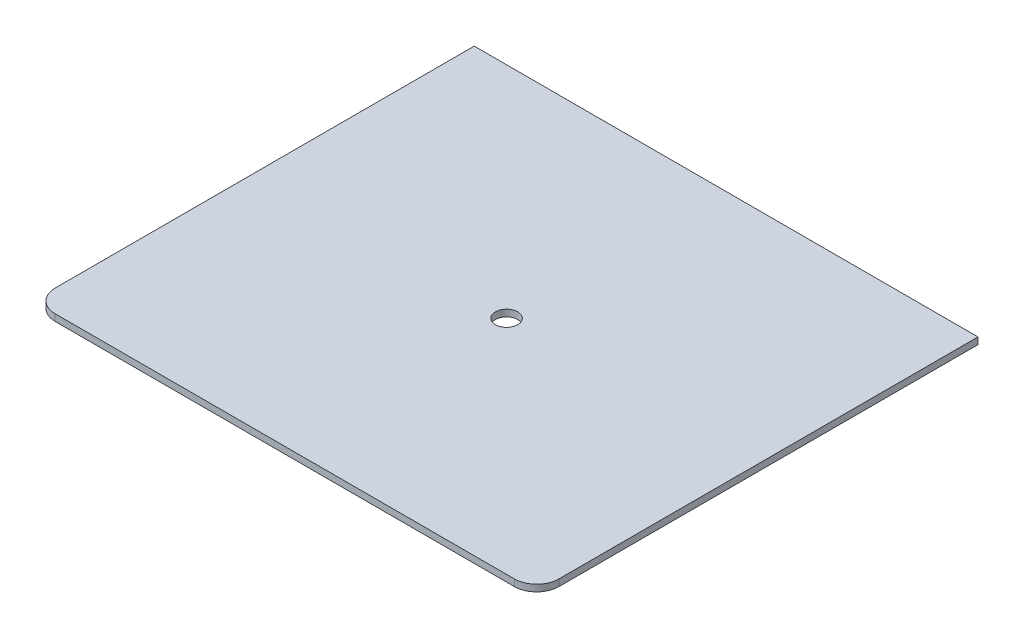
from build123d import *

# Parameters (mm, degrees)
SKETCH1_W           = 226
SKETCH1_H           = 198
BOSS_EXTRUDE1_DEPTH = 3
INPUT_FOR_SPEAKER_R = 5
CUT_EXTRUDE1_DEPTH  = 10
FILLET1_R           = 10


with BuildPart() as part:
    # Sketch1 → Boss-Extrude1 (new body)
    with BuildSketch(Plane(origin=(0, 0, 0), x_dir=(1, 0, 0), z_dir=(0, 1, 0))):
        with Locations((113, 99)):
            Rectangle(SKETCH1_W, SKETCH1_H)
    extrude(amount=BOSS_EXTRUDE1_DEPTH)

    # Input for speaker → Cut-Extrude1 (cut)
    with BuildSketch(Plane(origin=(0, 3, 0), x_dir=(1, 0, 0), z_dir=(0, 1, 0))):
        with Locations(Location((113, 99.5, 0), (0, 0, 270))):
            Circle(INPUT_FOR_SPEAKER_R)
    extrude(amount=-CUT_EXTRUDE1_DEPTH, mode=Mode.SUBTRACT)

    # Fillet1
    fillet1_edges = [part.edges().sort_by_distance(p)[0] for p in [
        (226, 1.5, 0),
        (0, 1.5, 0),
    ]]
    fillet(fillet1_edges, radius=FILLET1_R)


solid = part.part
